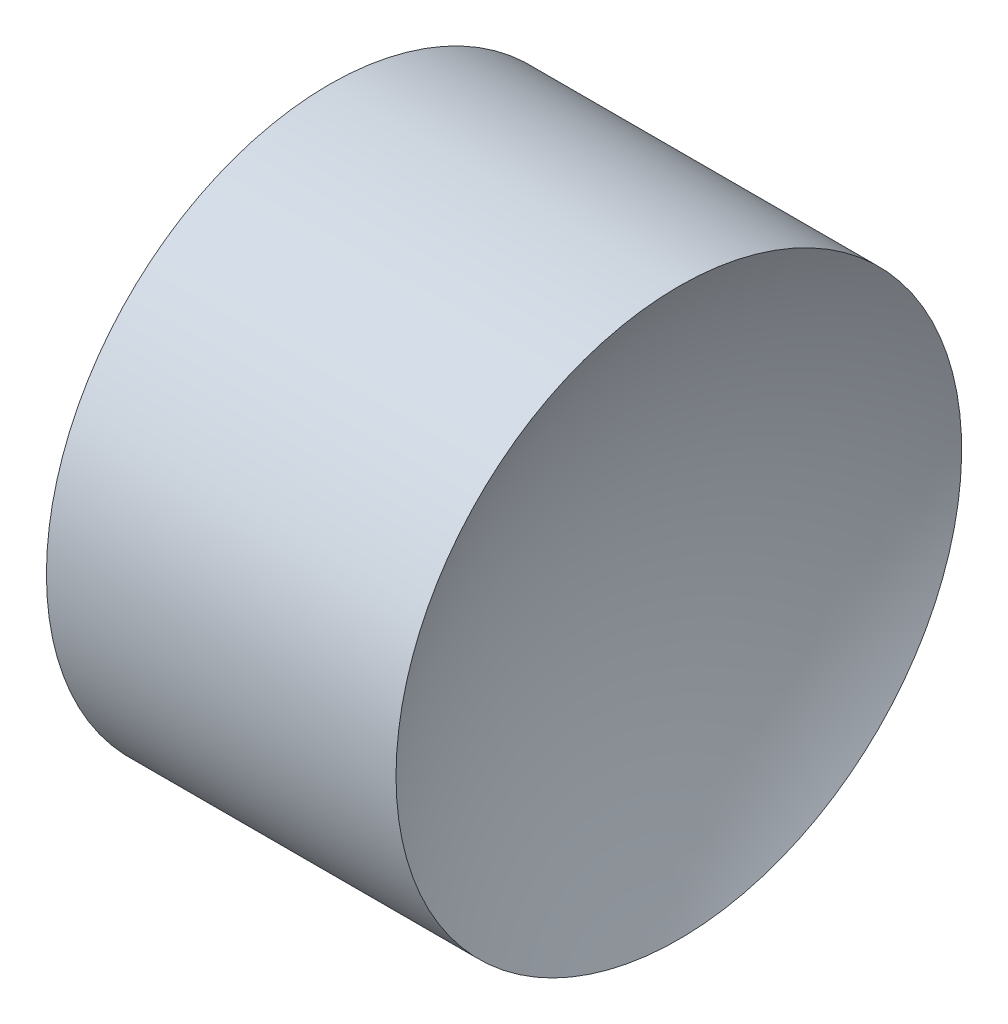
from build123d import *


with BuildPart() as part:
    # 草图1 → 旋转1 (revolve)
    with BuildSketch(Plane.XY):
        with BuildLine():
            ThreePointArc((0, 0.65), (0.155126411, 0.341316514), (0.20853741, 0))
            Line((0.20853741, 0), (0.632151821, 0))
            ThreePointArc((0.632151821, 0), (0.675699544, 0.336098491), (0.803466688, 0.65))
            Line((0.803466688, 0.65), (0.606933375, 0.65))
            Line((0.606933375, 0.65), (0, 0.65))
        make_face()
    revolve(axis=Axis((0.20853741, 0, 0), (1, 0, 0)))


solid = part.part
